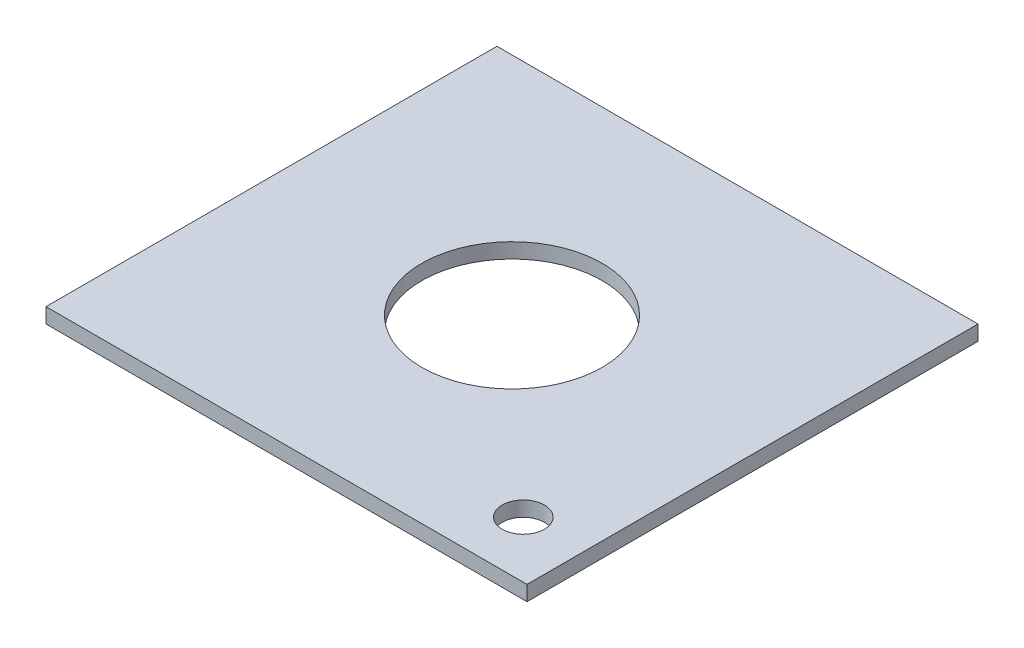
from build123d import *

# Parameters (mm, degrees)
SKETCH2_W           = 80
SKETCH2_H           = 75
SKETCH2_R           = 15
SKETCH2_R_2         = 3.5
BOSS_EXTRUDE1_DEPTH = 2.5


with BuildPart() as part:
    # Sketch2 → Boss-Extrude1 (new body)
    with BuildSketch(Plane(origin=(0, 0, 0), x_dir=(1, 0, 0), z_dir=(0, 1, 0))):
        Rectangle(SKETCH2_W, SKETCH2_H)
        with Locations(Location((0, 0, 0), (0, 0, 270))):
            Circle(SKETCH2_R, mode=Mode.SUBTRACT)
        with Locations(Location((30, -28.125, 0), (0, 0, 270))):
            Circle(SKETCH2_R_2, mode=Mode.SUBTRACT)
    extrude(amount=BOSS_EXTRUDE1_DEPTH)


solid = part.part
